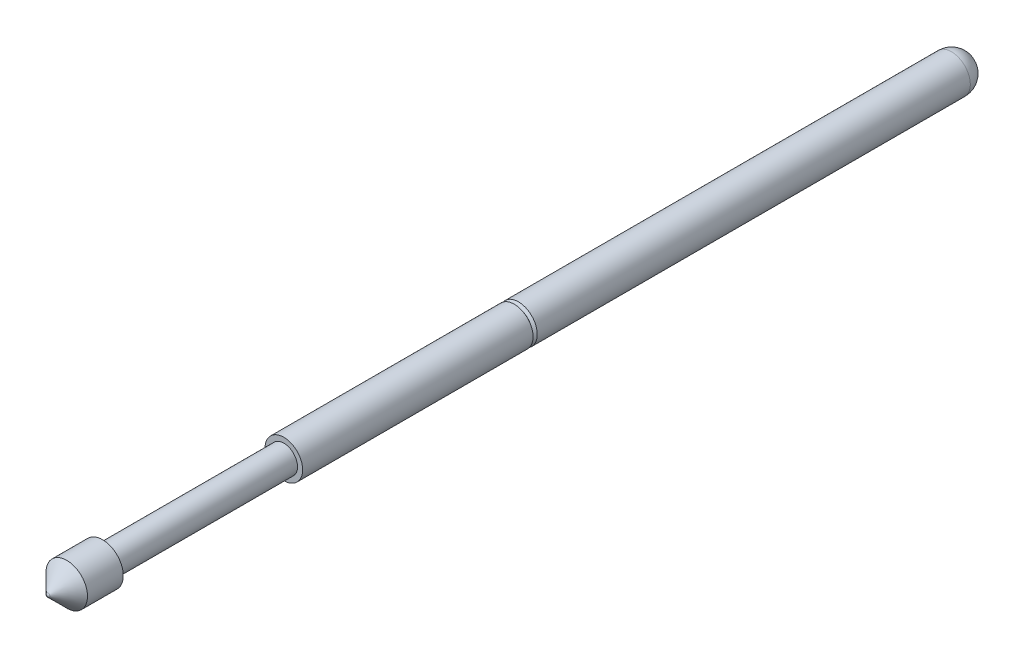
from build123d import *


with BuildPart() as part:
    # Эскиз1 → Повернуть1 (revolve)
    with BuildSketch(Plane(origin=(0, 0, 0), x_dir=(1, 0, 0), z_dir=(0, 1, 0))):
        with BuildLine():
            Line((0, 0), (0, -33.35))
            ThreePointArc((0, -33.35), (-0.038268343, -33.342387953), (-0.070710678, -33.320710678))
            Line((-0.070710678, -33.320710678), (-0.75, -32.641421356))
            Line((-0.75, -32.641421356), (-0.75, -31.35))
            Line((-0.75, -31.35), (-0.495, -31.35))
            Line((-0.495, -31.35), (-0.495, -24.8))
            Line((-0.495, -24.8), (-0.68, -24.8))
            Line((-0.68, -24.8), (-0.68, -16.475))
            Line((-0.68, -16.475), (-0.579289322, -16.4))
            Line((-0.579289322, -16.4), (-0.68, -16.325))
            Line((-0.68, -16.325), (-0.68, -0.68))
            ThreePointArc((-0.68, -0.68), (-0.480832611, -0.199167389), (0, 0))
        make_face()
    revolve(axis=Axis((0, 0, 0), (0, 0, 1)))


solid = part.part
